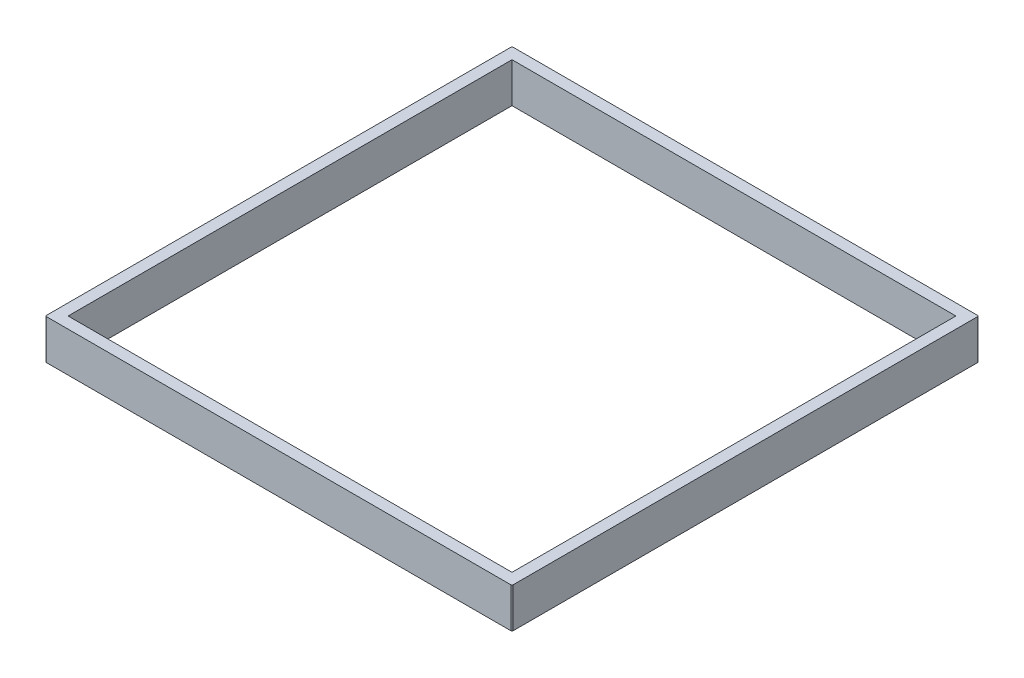
from build123d import *

# Parameters (mm, degrees)
SKETCH1_W  = 78
SKETCH1_H  = 78
COIL_DEPTH = 7


with BuildPart() as part:
    # Sketch1 → Coil (new body)
    with BuildSketch(Plane(origin=(0, 0, 0), x_dir=(1, 0, 0), z_dir=(0, 1, 0))):
        with BuildLine():
            Line((0.2, -11), (81.8, -11))
            ThreePointArc((81.8, -11), (81.941421356, -10.941421356), (82, -10.8))
            Line((82, -10.8), (82, 70.8))
            ThreePointArc((82, 70.8), (81.941421356, 70.941421356), (81.8, 71))
            Line((81.8, 71), (0.2, 71))
            ThreePointArc((0.2, 71), (0.058578644, 70.941421356), (0, 70.8))
            Line((0, 70.8), (0, -10.8))
            ThreePointArc((0, -10.8), (0.058578644, -10.941421356), (0.2, -11))
        make_face()
        with Locations((41, 30)):
            Rectangle(SKETCH1_W, SKETCH1_H, mode=Mode.SUBTRACT)
    extrude(amount=COIL_DEPTH)


solid = part.part
